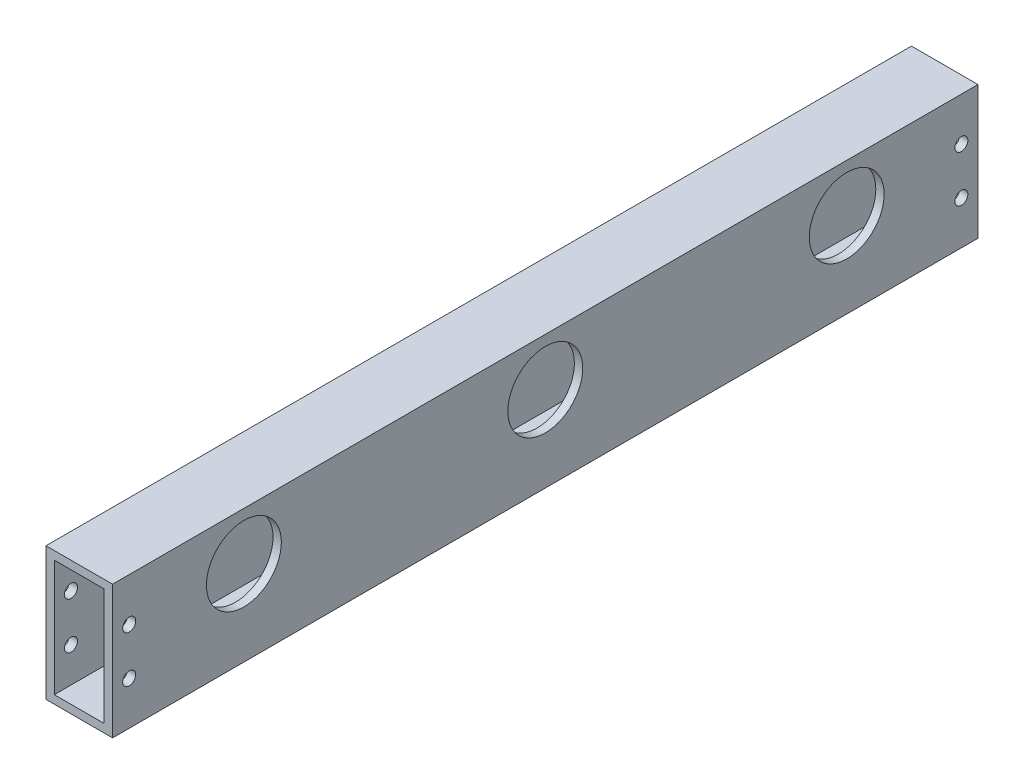
from build123d import *

# Parameters (mm, degrees)
SKETCH1_W                  = 330.2
SKETCH1_H                  = 50.8
SKETCH1_R                  = 14.2875
BOSS_EXTRUDE1_DEPTH        = 25.4
SHELL1_T                   = -3.175
F_9_0_196_DIAMETER_HOLE1_D = 4.9784


with BuildPart() as part:
    # Sketch1 → Boss-Extrude1 (new body)
    with BuildSketch(Plane(origin=(0, 0, 0), x_dir=(0, 0, -1), z_dir=(1, 0, 0))):
        Rectangle(SKETCH1_W, SKETCH1_H)
        with Locations((115, 7.112)):
            Circle(SKETCH1_R, mode=Mode.SUBTRACT)
        with Locations((-115, 7.112)):
            Circle(SKETCH1_R, mode=Mode.SUBTRACT)
        with Locations((0, 7.112)):
            Circle(SKETCH1_R, mode=Mode.SUBTRACT)
    extrude(amount=BOSS_EXTRUDE1_DEPTH)

    # Shell1
    shell1_openings = [part.faces().sort_by_distance(p)[0] for p in [
        (12.7, 0, -165.1),
        (12.7, 0, 165.1),
        (12.7, 7.112, 14.2875),
        (12.7, 7.112, 129.2875),
        (12.7, 7.112, -100.7125),
    ]]
    offset(amount=SHELL1_T, openings=shell1_openings, kind=Kind.INTERSECTION)

    # #9 (0.196) Diameter Hole1 (through all)
    with Locations(Plane(origin=(25.4, 0, 0), x_dir=(0, 0, -1), z_dir=(1, 0, 0))):
        with Locations((-158.75, 8.89), (-158.75, -8.89)):
            f_9_0_196_diameter_hole1 = Hole(F_9_0_196_DIAMETER_HOLE1_D / 2)

    # Mirror1: #9 (0.196) Diameter Hole1 across plane
    add(f_9_0_196_diameter_hole1.mirror(Plane.XY), mode=Mode.SUBTRACT)


solid = part.part
